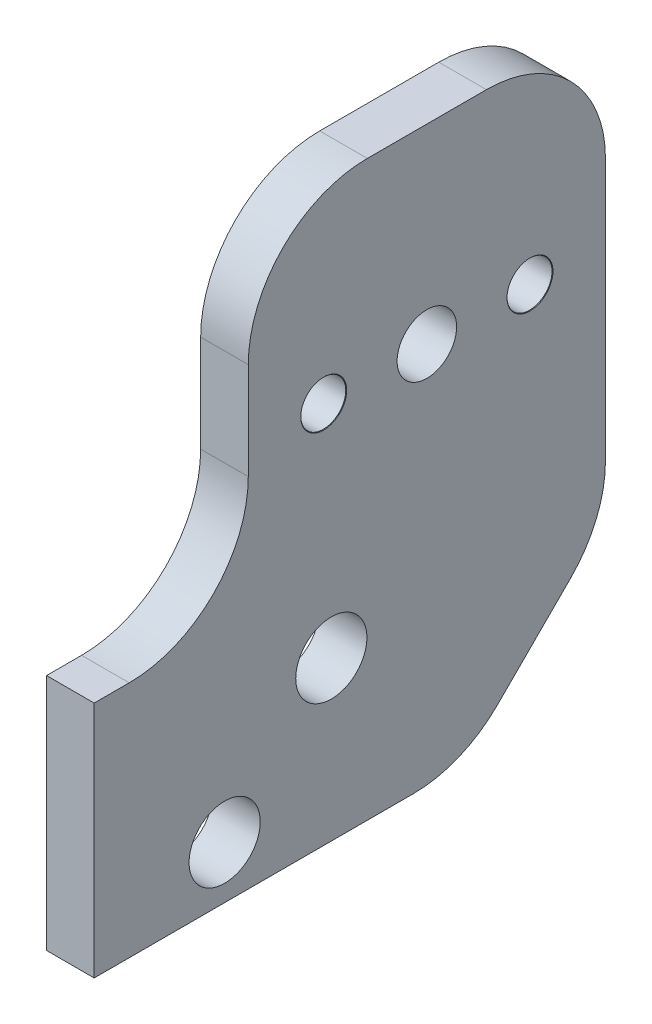
from build123d import *

# Parameters (mm, degrees)
SKETCH1_W                      = 19.05
SKETCH1_H                      = 30.5721766
BOSS_EXTRUDE1_DEPTH            = 2.54
SKETCH2_R                      = 1.5875
CUT_EXTRUDE1_DEPTH             = 33.122191816
M2_CLEARANCE_HOLE1_D           = 2.4
M2_CLEARANCE_HOLE1_DEPTH       = 12.0000014
M2_CLEARANCE_HOLE1_CSINK_D     = 2.45
M2_CLEARANCE_HOLE1_CSINK_ANGLE = 90
M2_CLEARANCE_HOLE1_TIP         = 0.721032743
SKETCH6_W                      = 8.2193384
SKETCH6_H                      = 12.7
BOSS_EXTRUDE2_DEPTH            = 2.54
CHAMFER1_SIZE                  = 7.62
FILLET2_R                      = 6.35
F_6_CLEARANCE_HOLE1_D          = 3.7973


with BuildPart() as part:
    # Sketch1 → Boss-Extrude1 (new body)
    with BuildSketch(Plane(origin=(0, 0, 0), x_dir=(0, 0, -1), z_dir=(1, 0, 0))):
        with Locations((0, 15.2860883)):
            Rectangle(SKETCH1_W, SKETCH1_H)
    extrude(amount=BOSS_EXTRUDE1_DEPTH)

    # Sketch2 → Cut-Extrude1 (cut, through all)
    with BuildSketch(Plane(origin=(2.54, 0, 0), x_dir=(0, 0, -1), z_dir=(1, 0, 0))):
        with Locations((0, 20.4121766)):
            Circle(SKETCH2_R)
    extrude(amount=-CUT_EXTRUDE1_DEPTH, mode=Mode.SUBTRACT)

    # M2 Clearance Hole1
    with Locations(Plane(origin=(2.54, 0, 0), x_dir=(0, 0, -1), z_dir=(1, 0, 0))):
        with Locations((-5.5, 20.4121766), (5.5, 20.4121766)):
            CounterSinkHole(M2_CLEARANCE_HOLE1_D / 2, M2_CLEARANCE_HOLE1_CSINK_D / 2, depth=M2_CLEARANCE_HOLE1_DEPTH, counter_sink_angle=M2_CLEARANCE_HOLE1_CSINK_ANGLE)
            with Locations((0, 0, -(M2_CLEARANCE_HOLE1_DEPTH + M2_CLEARANCE_HOLE1_TIP / 2))):  # 118° drill point
                Cone(0, M2_CLEARANCE_HOLE1_D / 2, M2_CLEARANCE_HOLE1_TIP, mode=Mode.SUBTRACT)

    # Sketch6 → Boss-Extrude2 (add)
    with BuildSketch(Plane(origin=(0, 0, 0), x_dir=(0, 0, -1), z_dir=(1, 0, 0))):
        with Locations((-13.6346692, 6.35)):
            Rectangle(SKETCH6_W, SKETCH6_H)
    extrude(amount=BOSS_EXTRUDE2_DEPTH)

    # Chamfer1
    chamfer1_edges = [part.edges().sort_by_distance(p)[0] for p in [
        (1.27, 0, -9.525),
    ]]
    chamfer(chamfer1_edges, length=CHAMFER1_SIZE)

    # Fillet2
    fillet2_edges = [part.edges().sort_by_distance(p)[0] for p in [
        (1.27, 12.7, 9.525),
        (1.27, 7.62, -9.525),
        (1.27, 0, -1.905),
        (1.27, 30.5721766, 9.525),
        (1.27, 30.5721766, -9.525),
    ]]
    fillet(fillet2_edges, radius=FILLET2_R)

    # #6 Clearance Hole1 (through all)
    with Locations(Plane.ZY):
        with Locations((10.7847384, 2.794), (5.0951384, 8.4582)):
            Hole(F_6_CLEARANCE_HOLE1_D / 2)


solid = part.part
